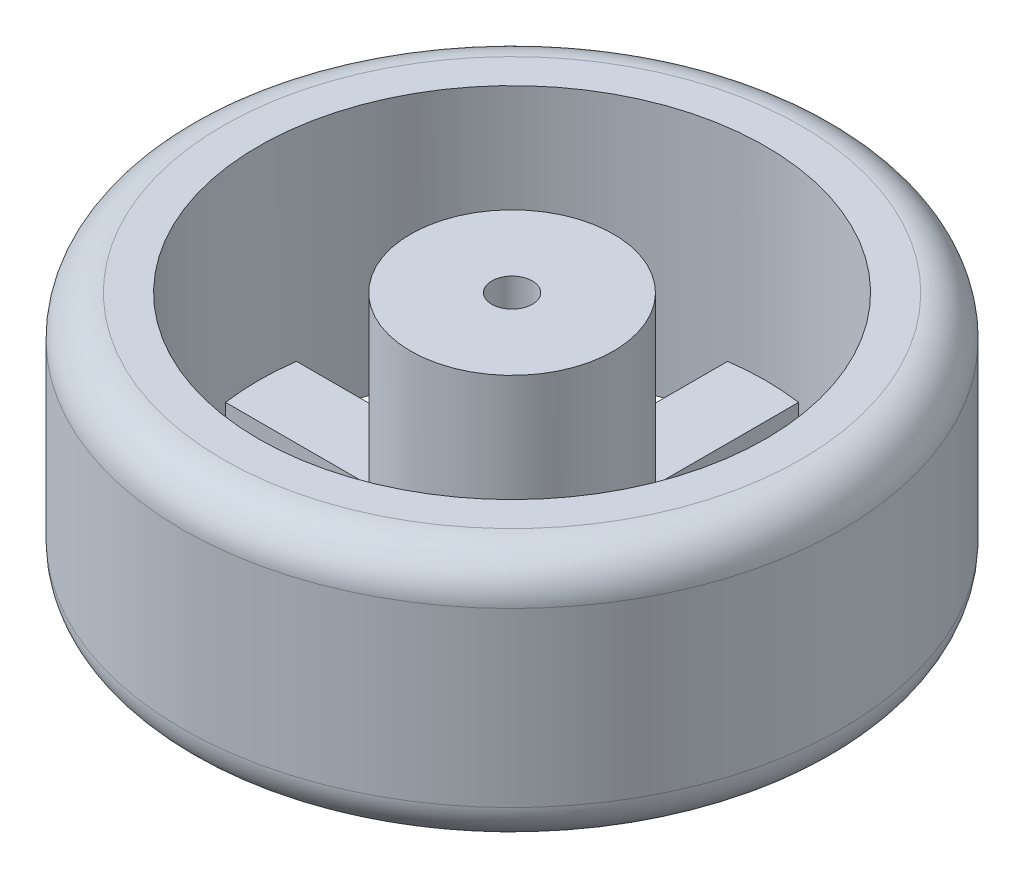
from build123d import *

# Parameters (mm, degrees)
SKETCH1_R           = 32.5
SKETCH1_R_2         = 25
BOSS_EXTRUDE1_DEPTH = 25
SKETCH2_R           = 10
BOSS_EXTRUDE3_DEPTH = 25
SKETCH4_R           = 2
CUT_EXTRUDE1_DEPTH  = 10
BOSS_EXTRUDE5_DEPTH = 5
FILLET4_R           = 4


with BuildPart() as part:
    # Sketch1 → Boss-Extrude1 (new body)
    with BuildSketch(Plane(origin=(0, 0, 0), x_dir=(1, 0, 0), z_dir=(0, 1, 0))):
        with Locations(Location((0, 0, 0), (0, 0, 270))):
            Circle(SKETCH1_R)
        with Locations(Location((0, 0, 0), (0, 0, 270))):
            Circle(SKETCH1_R_2, mode=Mode.SUBTRACT)
    extrude(amount=BOSS_EXTRUDE1_DEPTH)



with BuildPart() as body_2:
    # Sketch2 → Boss-Extrude3 (new body)
    with BuildSketch(Plane(origin=(0, 25, 0), x_dir=(1, 0, 0), z_dir=(0, 1, 0))):
        with Locations(Location((0, 0, 0), (0, 0, 270))):
            Circle(SKETCH2_R)
    extrude(amount=-BOSS_EXTRUDE3_DEPTH)

    # Sketch4 → Cut-Extrude1 (cut)
    with BuildSketch(Plane(origin=(0, 25, 0), x_dir=(1, 0, 0), z_dir=(0, 1, 0))):
        with Locations(Location((0, 0, 0), (0, 0, 270))):
            Circle(SKETCH4_R)
    extrude(amount=-CUT_EXTRUDE1_DEPTH, mode=Mode.SUBTRACT)


with BuildPart() as part_1:
    add(part.part)

    add(body_2.part)  # Boss-Extrude5 merges body 2
    # Sketch6 → Boss-Extrude5 (add)
    with BuildSketch(Plane(origin=(0, 0, 0), x_dir=(-1, 0, 0), z_dir=(0, -1, 0))):
        with BuildLine():
            Line((3.5, 3.5), (3.5, 25))
            ThreePointArc((3.5, 25), (0, 28.5), (-3.5, 25))
            Line((-3.5, 25), (-3.5, 3.5))
            Line((-3.5, 3.5), (3.5, 3.5))
        make_face()
        with BuildLine():
            Line((25, 3.5), (3.5, 3.5))
            Line((3.5, 3.5), (3.5, -3.5))
            Line((3.5, -3.5), (25, -3.5))
            ThreePointArc((25, -3.5), (28.5, 0), (25, 3.5))
        make_face()
        with BuildLine():
            Line((3.5, -25), (3.5, -3.5))
            Line((3.5, -3.5), (-3.5, -3.5))
            Line((-3.5, -3.5), (-3.5, -25))
            ThreePointArc((-3.5, -25), (0, -28.5), (3.5, -25))
        make_face()
        with BuildLine():
            Line((-3.5, -3.5), (-3.5, 3.5))
            Line((-3.5, 3.5), (-25, 3.5))
            ThreePointArc((-25, 3.5), (-28.5, 0), (-25, -3.5))
            Line((-25, -3.5), (-3.5, -3.5))
        make_face()
    extrude(amount=-BOSS_EXTRUDE5_DEPTH)

    # Fillet4
    fillet4_edges = [part_1.edges().sort_by_distance(p)[0] for p in [
        (0, 0, -32.5),
        (0, 25, -32.5),
    ]]
    fillet(fillet4_edges, radius=FILLET4_R)


solid = part_1.part
